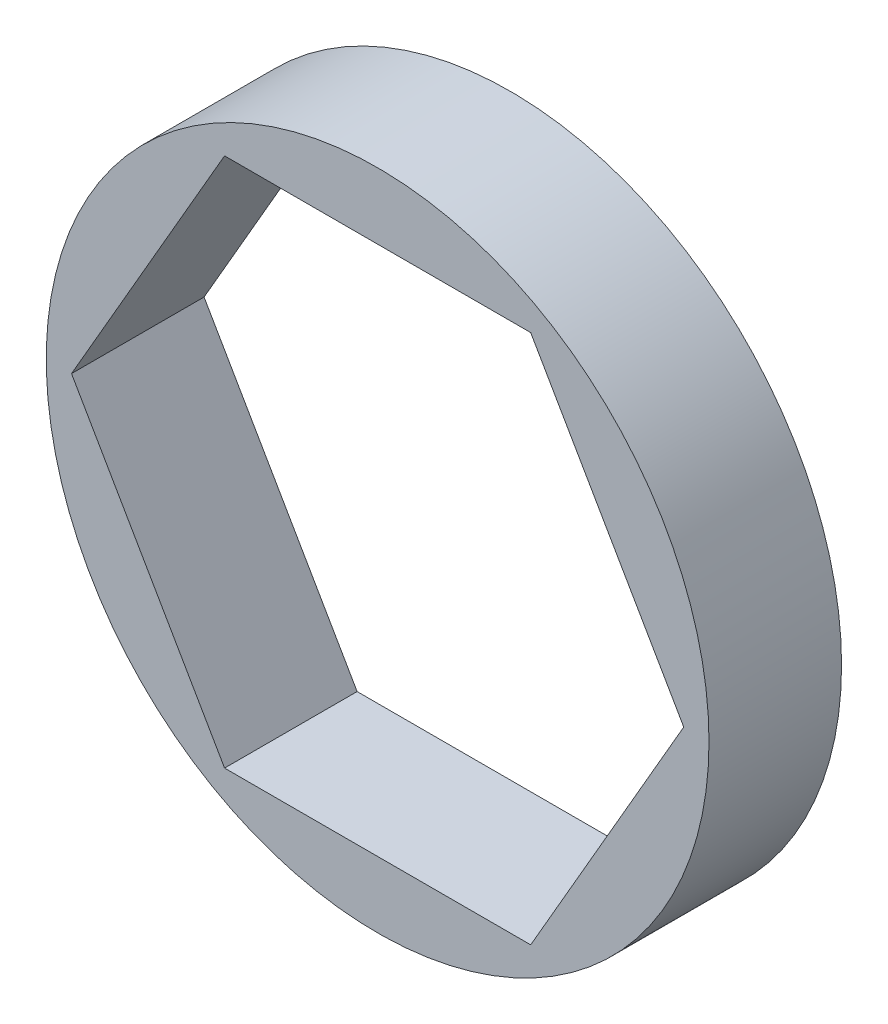
from build123d import *

# Parameters (mm, degrees)
SKETCH1_R           = 7.9375
BOSS_EXTRUDE1_DEPTH = 3.175


with BuildPart() as part:
    # Sketch1 → Boss-Extrude1 (new body)
    with BuildSketch(Plane.XY):
        Circle(SKETCH1_R)
        Polygon((-3.666174209, -6.35), (3.666174209, -6.35), (7.332348419, 0), (3.666174209, 6.35), (-3.666174209, 6.35), (-7.332348419, 0), align=None, mode=Mode.SUBTRACT)
    extrude(amount=BOSS_EXTRUDE1_DEPTH)


solid = part.part
